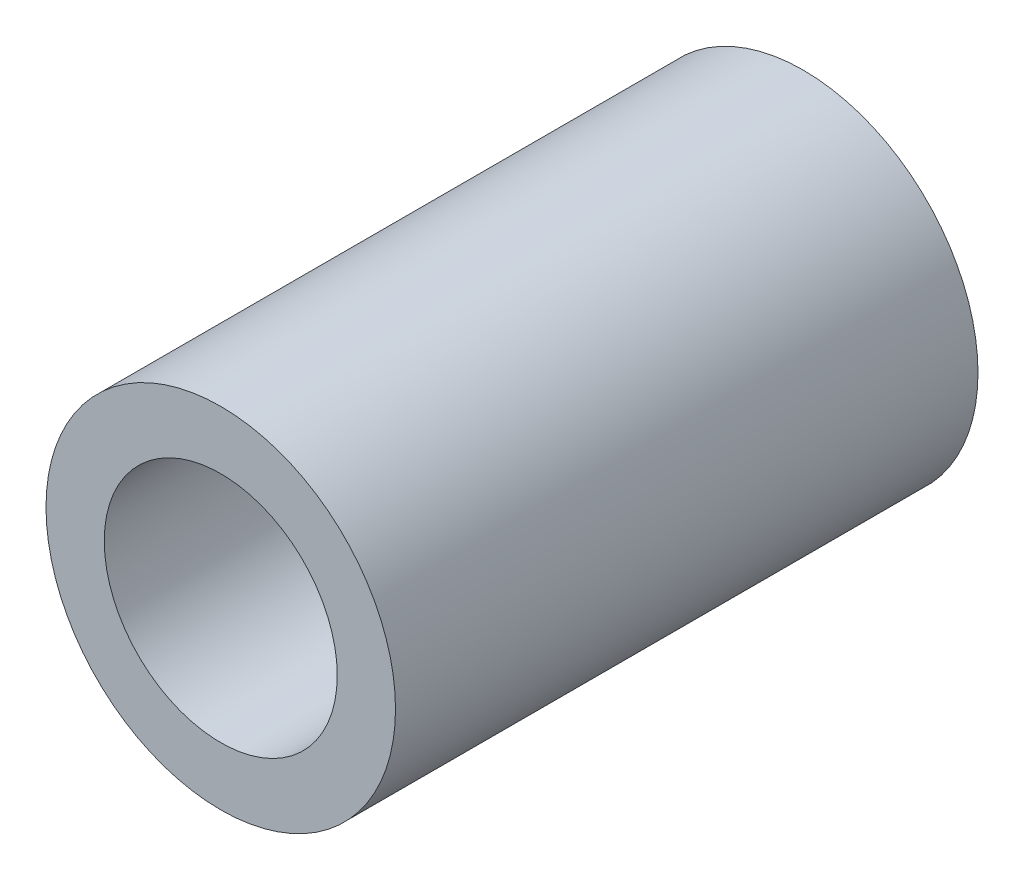
from build123d import *

# Parameters (mm, degrees)
ESBO_O1_R                = 4.5
RESSALTO_EXTRUS_O1_DEPTH = 15
ESBO_O2_R                = 3
CORTE_EXTRUS_O1_DEPTH    = 5
ESBO_O3_R                = 2
CORTE_EXTRUS_O2_DEPTH    = 5


with BuildPart() as part:
    # Esboço1 → Ressalto-extrusão1 (new body)
    with BuildSketch(Plane.XY):
        Circle(ESBO_O1_R)
    extrude(amount=RESSALTO_EXTRUS_O1_DEPTH)

    # Esboço2 → Corte-extrusão1 (cut)
    with BuildSketch(Plane.XY.offset(15)):
        Circle(ESBO_O2_R)
    extrude(amount=-CORTE_EXTRUS_O1_DEPTH, mode=Mode.SUBTRACT)

    # Esboço3 → Corte-extrusão2 (cut)
    with BuildSketch(Plane(origin=(0, 0, 0), x_dir=(-1, 0, 0), z_dir=(0, 0, -1))):
        Circle(ESBO_O3_R)
    extrude(amount=-CORTE_EXTRUS_O2_DEPTH, mode=Mode.SUBTRACT)


solid = part.part
